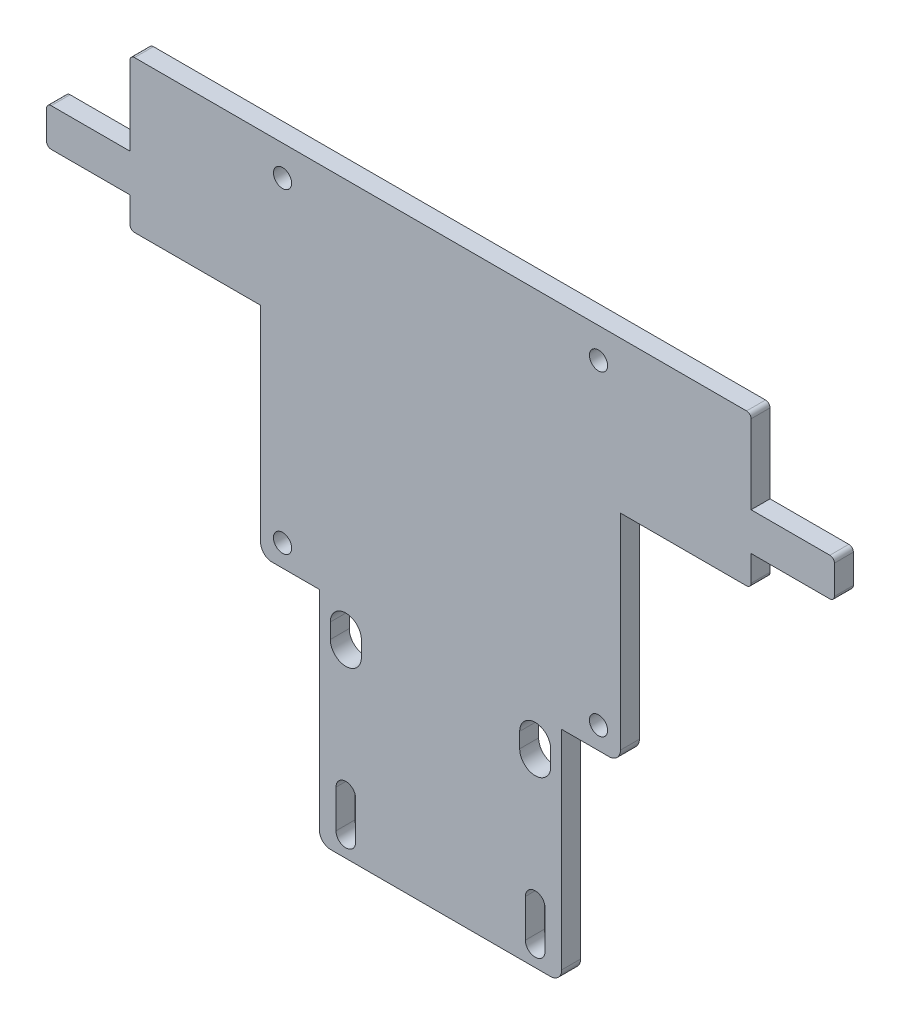
from build123d import *

# Parameters (mm, degrees)
SKETCH1_R           = 1.524
BOSS_EXTRUDE1_DEPTH = 3.175


with BuildPart() as part:
    # Sketch1 → Boss-Extrude1 (new body)
    with BuildSketch(Plane.XY):
        with BuildLine():
            Line((0.762, 0), (21.9075, 0))
            Line((21.9075, 0), (21.9075, -34.42335))
            ThreePointArc((21.9075, -34.42335), (22.465461582, -35.770388418), (23.8125, -36.32835))
            Line((23.8125, -36.32835), (31.75, -36.32835))
            Line((31.75, -36.32835), (31.75, -71.25335))
            ThreePointArc((31.75, -71.25335), (32.307961582, -72.600388418), (33.655, -73.15835))
            Line((33.655, -73.15835), (70.485, -73.15835))
            ThreePointArc((70.485, -73.15835), (71.832038418, -72.600388418), (72.39, -71.25335))
            Line((72.39, -71.25335), (72.39, -36.32835))
            Line((72.39, -36.32835), (80.3275, -36.32835))
            ThreePointArc((80.3275, -36.32835), (81.674538418, -35.770388418), (82.2325, -34.42335))
            Line((82.2325, -34.42335), (82.2325, 0))
            Line((82.2325, 0), (103.378, 0))
            ThreePointArc((103.378, 0), (103.916815367, 0.223184633), (104.14, 0.762))
            Line((104.14, 0.762), (104.14, 5.08))
            Line((104.14, 5.08), (117.348, 5.08))
            ThreePointArc((117.348, 5.08), (117.886815367, 5.303184633), (118.11, 5.842))
            Line((118.11, 5.842), (118.11, 10.668))
            ThreePointArc((118.11, 10.668), (117.886815367, 11.206815367), (117.348, 11.43))
            Line((117.348, 11.43), (104.14, 11.43))
            Line((104.14, 11.43), (104.14, 24.638))
            ThreePointArc((104.14, 24.638), (103.916815367, 25.176815367), (103.378, 25.4))
            Line((103.378, 25.4), (0.762, 25.4))
            ThreePointArc((0.762, 25.4), (0.223184633, 25.176815367), (0, 24.638))
            Line((0, 24.638), (0, 11.43))
            Line((0, 11.43), (-13.208, 11.43))
            ThreePointArc((-13.208, 11.43), (-13.746815367, 11.206815367), (-13.97, 10.668))
            Line((-13.97, 10.668), (-13.97, 5.842))
            ThreePointArc((-13.97, 5.842), (-13.746815367, 5.303184633), (-13.208, 5.08))
            Line((-13.208, 5.08), (0, 5.08))
            Line((0, 5.08), (0, 0.762))
            ThreePointArc((0, 0.762), (0.223184633, 0.223184633), (0.762, 0))
        make_face()
        with Locations((25.58415, 20.32)):
            Circle(SKETCH1_R, mode=Mode.SUBTRACT)
        with Locations((78.55585, 20.32)):
            Circle(SKETCH1_R, mode=Mode.SUBTRACT)
        with Locations(Location((78.55585, -32.6517, 0), (0, 0, 180))):
            Circle(SKETCH1_R, mode=Mode.SUBTRACT)
        with Locations(Location((25.58415, -32.6517, 0), (0, 0, 180))):
            Circle(SKETCH1_R, mode=Mode.SUBTRACT)
        with BuildLine():
            Line((38.7985, -40.13835), (38.7985, -42.67835))
            ThreePointArc((38.7985, -42.67835), (36.195, -45.28185), (33.5915, -42.67835))
            Line((33.5915, -42.67835), (33.5915, -40.13835))
            ThreePointArc((33.5915, -40.13835), (36.195, -37.53485), (38.7985, -40.13835))
        make_face(mode=Mode.SUBTRACT)
        with BuildLine():
            Line((70.5485, -40.13835), (70.5485, -42.67835))
            ThreePointArc((70.5485, -42.67835), (67.945, -45.28185), (65.3415, -42.67835))
            Line((65.3415, -42.67835), (65.3415, -40.13835))
            ThreePointArc((65.3415, -40.13835), (67.945, -37.53485), (70.5485, -40.13835))
        make_face(mode=Mode.SUBTRACT)
        with BuildLine():
            Line((69.595, -63.63335), (69.595, -69.98335))
            ThreePointArc((69.595, -69.98335), (67.945, -71.63335), (66.295, -69.98335))
            Line((66.295, -69.98335), (66.295, -63.63335))
            ThreePointArc((66.295, -63.63335), (67.945, -61.98335), (69.595, -63.63335))
        make_face(mode=Mode.SUBTRACT)
        with BuildLine():
            Line((37.845, -63.63335), (37.845, -69.98335))
            ThreePointArc((37.845, -69.98335), (36.195, -71.63335), (34.545, -69.98335))
            Line((34.545, -69.98335), (34.545, -63.63335))
            ThreePointArc((34.545, -63.63335), (36.195, -61.98335), (37.845, -63.63335))
        make_face(mode=Mode.SUBTRACT)
    extrude(amount=BOSS_EXTRUDE1_DEPTH)


solid = part.part
